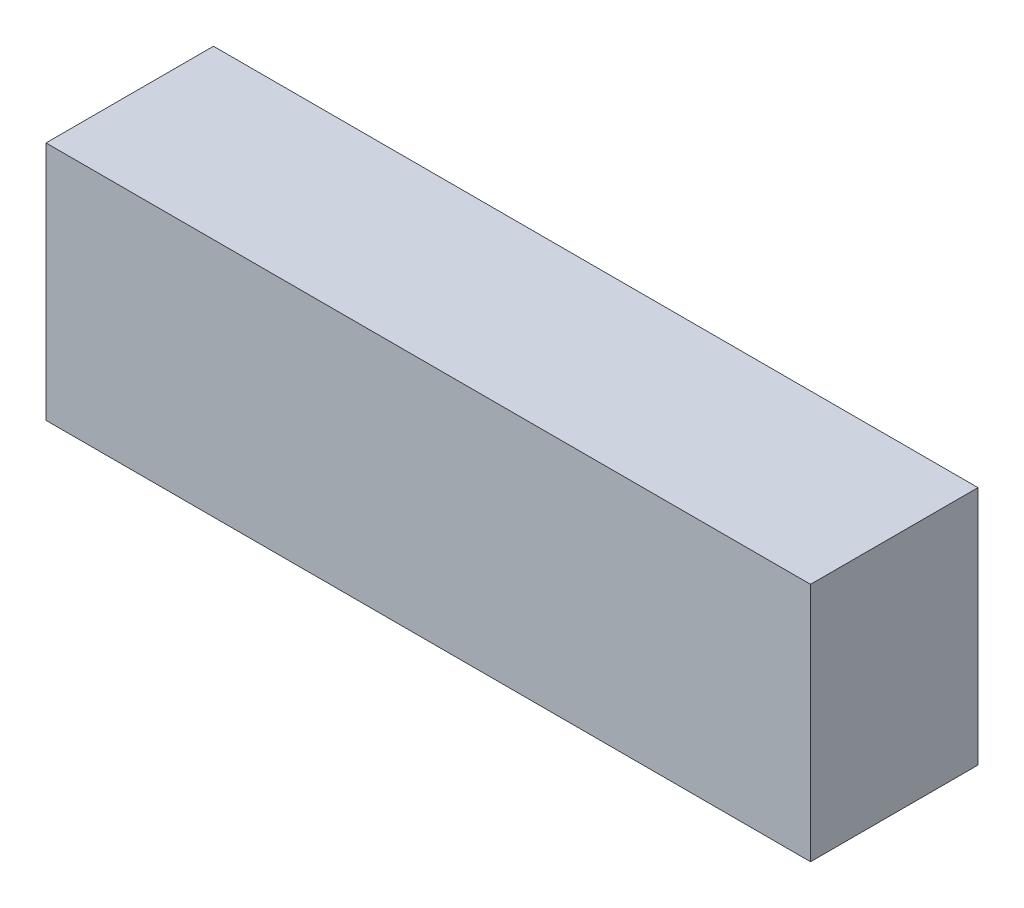
from build123d import *

# Parameters (mm, degrees)
SKETCH_1_W      = 105
SKETCH_1_H      = 33
EXTRUDE_1_DEPTH = 23


with BuildPart() as part:
    # 草图1 → 凸台-拉伸1 (new body)
    with BuildSketch(Plane.XY):
        Rectangle(SKETCH_1_W, SKETCH_1_H)
    extrude(amount=EXTRUDE_1_DEPTH)


solid = part.part
